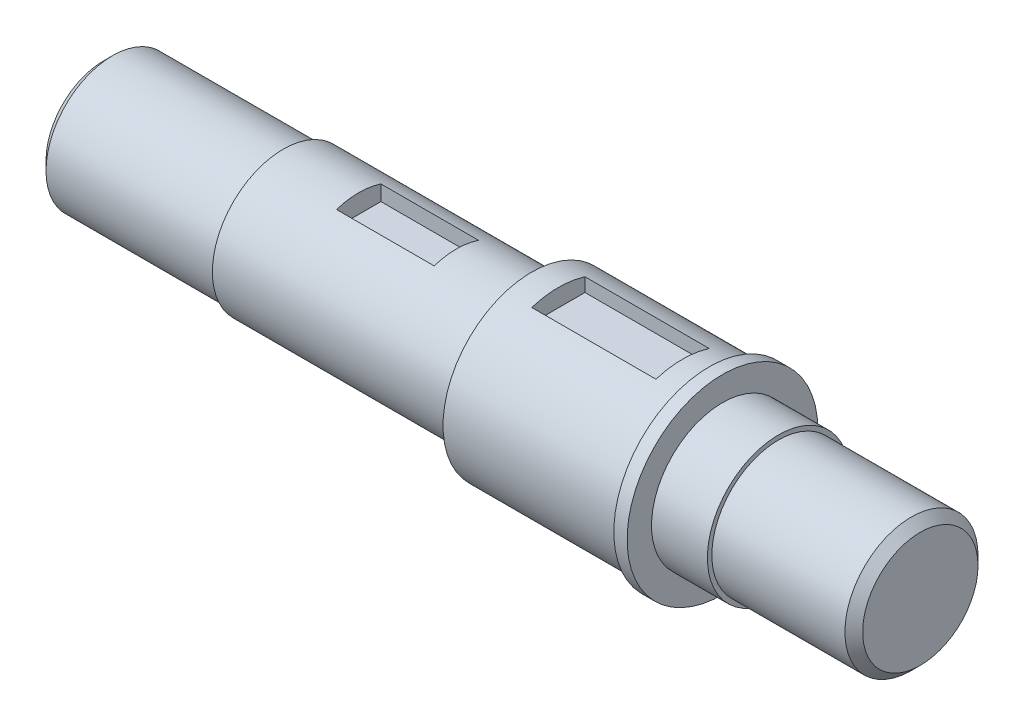
from build123d import *

# Parameters (mm, degrees)
CHAMFER_1_SIZE      = 2
CUT_EXTRUDE_START   = 11.75
SKETCH_3_W          = 22
SKETCH_3_H          = 5
CUT_EXTRUDE_1_DEPTH = 25
CUT_EXTRUDE_START_2 = 16
SKETCH_4_W          = 28
SKETCH_4_H          = 6
CUT_EXTRUDE_2_DEPTH = 11


with BuildPart() as part:
    # 草图2 → 旋转1 (revolve)
    with BuildSketch(Plane(origin=(0, 0, 0), x_dir=(1, 0, 0), z_dir=(0, 1, 0))):
        Polygon((0, 0), (0, 15), (40.5, 15), (40.5, 16), (96.5, 16), (96.5, 20), (136.5, 20), (136.5, 21.5), (139.5, 21.5), (139.5, 16), (152.1, 16), (152.1, 15), (184.1, 15), (184.1, 0), align=None)
    revolve(axis=Axis((184.1, 0, 0), (-1, 0, 0)))

    # 倒角1
    chamfer_1_edges = [part.edges().sort_by_distance(p)[0] for p in [
        (184.1, 0, 15),
        (0, 0, 15),
    ]]
    chamfer(chamfer_1_edges, length=CHAMFER_1_SIZE)

    # 草图3 → 切除-拉伸1 (cut)
    with BuildSketch(Plane(origin=(0, 0, 0), x_dir=(1, 0, 0), z_dir=(0, 1, 0)).offset(CUT_EXTRUDE_START)):
        with Locations((68.5, 2.5)):
            Rectangle(SKETCH_3_W, SKETCH_3_H)
        with Locations((68.5, -2.5)):
            Rectangle(SKETCH_3_W, SKETCH_3_H)
    extrude(amount=CUT_EXTRUDE_1_DEPTH, mode=Mode.SUBTRACT)

    # 草图4 → 切除-拉伸2 (cut)
    with BuildSketch(Plane(origin=(0, 0, 0), x_dir=(1, 0, 0), z_dir=(0, 1, 0)).offset(CUT_EXTRUDE_START_2)):
        with Locations((116.5, 3)):
            Rectangle(SKETCH_4_W, SKETCH_4_H)
        with Locations((116.5, -3)):
            Rectangle(SKETCH_4_W, SKETCH_4_H)
    extrude(amount=CUT_EXTRUDE_2_DEPTH, mode=Mode.SUBTRACT)


solid = part.part
